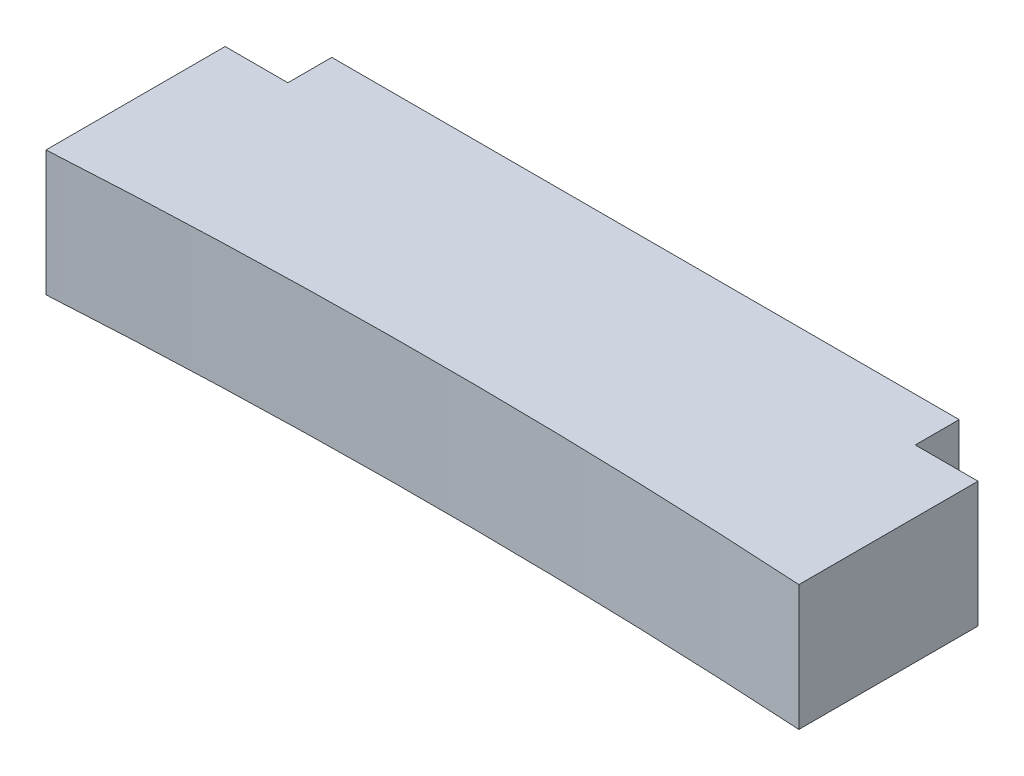
from build123d import *

# Parameters (mm, degrees)
BOSS_EXTRUDE1_DEPTH = 4


with BuildPart() as part:
    # Sketch1 → Boss-Extrude1 (new, symmetric)
    with BuildSketch(Plane(origin=(0, 0, 0), x_dir=(1, 0, 0), z_dir=(0, 1, 0))):
        with BuildLine():
            Line((-20, 0), (0, 0))
            Line((0, 0), (20, 0))
            Line((20, 0), (20, -2.8))
            Line((20, -2.8), (24, -2.8))
            Line((24, -2.8), (24, -14.220649169))
            ThreePointArc((24, -14.220649169), (0, -13.5), (-24, -14.220649169))
            Line((-24, -14.220649169), (-24, -2.8))
            Line((-24, -2.8), (-20, -2.8))
            Line((-20, -2.8), (-20, 0))
        make_face()
    extrude(amount=BOSS_EXTRUDE1_DEPTH, both=True)


solid = part.part
